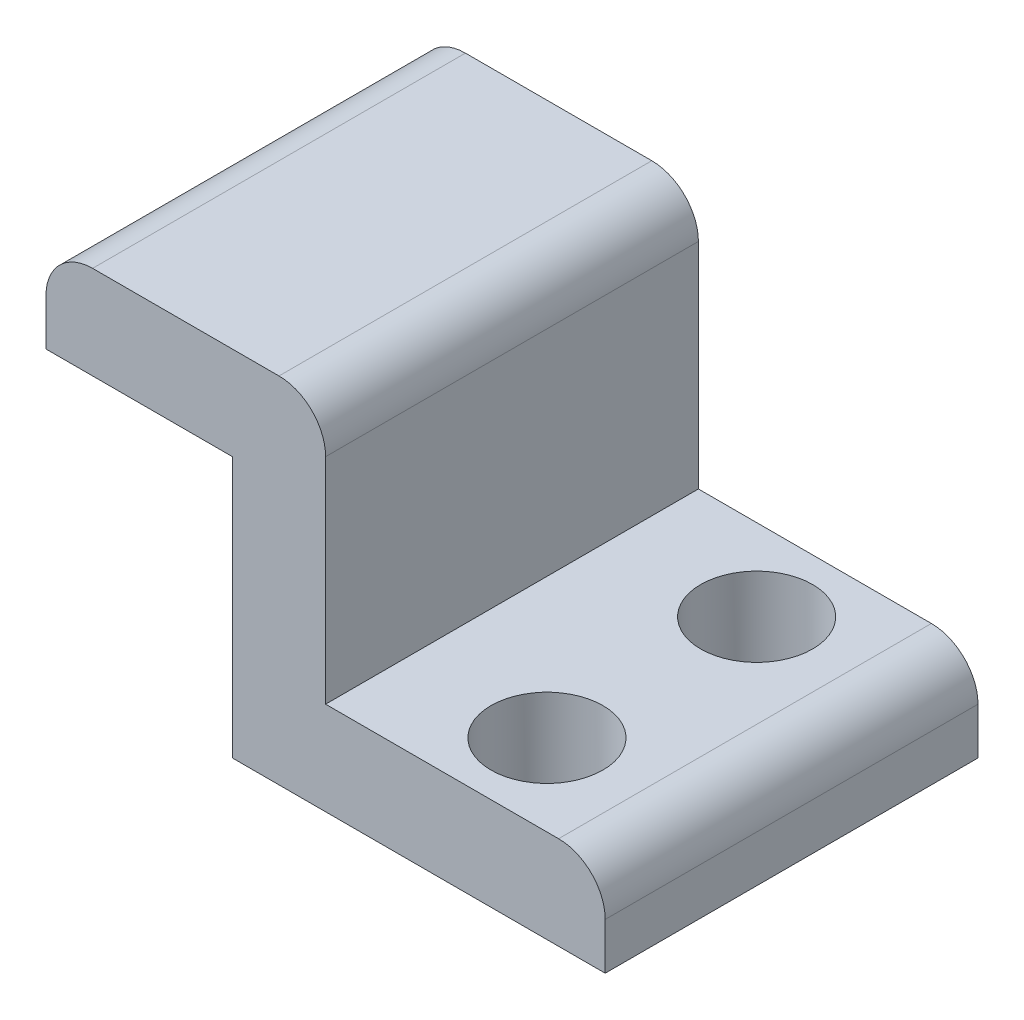
from build123d import *

# Parameters (mm, degrees)
BOSS_EXTRUDE1_DEPTH  = 8
M2_CLEARANCE_HOLE2_D = 2.4
M2_CLEARANCE_HOLE1_D = 2.4


with BuildPart() as part:
    # Sketch1 → Boss-Extrude1 (new body)
    with BuildSketch(Plane.XY):
        with BuildLine():
            Line((0, 0), (8, 0))
            Line((8, 0), (8, 1))
            ThreePointArc((8, 1), (7.707106781, 1.707106781), (7, 2))
            Line((7, 2), (2, 2))
            Line((2, 2), (2, 6.6))
            ThreePointArc((2, 6.6), (1.707106781, 7.307106781), (1, 7.6))
            Line((1, 7.6), (-3, 7.6))
            ThreePointArc((-3, 7.6), (-3.707106781, 7.307106781), (-4, 6.6))
            Line((-4, 6.6), (-4, 5.6))
            Line((-4, 5.6), (0, 5.6))
            Line((0, 5.6), (0, 0))
        make_face()
    extrude(amount=BOSS_EXTRUDE1_DEPTH)

    # M2 Clearance Hole2 (through all)
    with Locations(Plane(origin=(0, 12, 0), x_dir=(1, 0, 0), z_dir=(0, 1, 0))):
        with Locations((5, -1.75)):
            Hole(M2_CLEARANCE_HOLE2_D / 2)

    # M2 Clearance Hole1 (through all)
    with Locations(Plane(origin=(0, 12, 0), x_dir=(1, 0, 0), z_dir=(0, 1, 0))):
        with Locations((5, -6.25)):
            Hole(M2_CLEARANCE_HOLE1_D / 2)


solid = part.part
